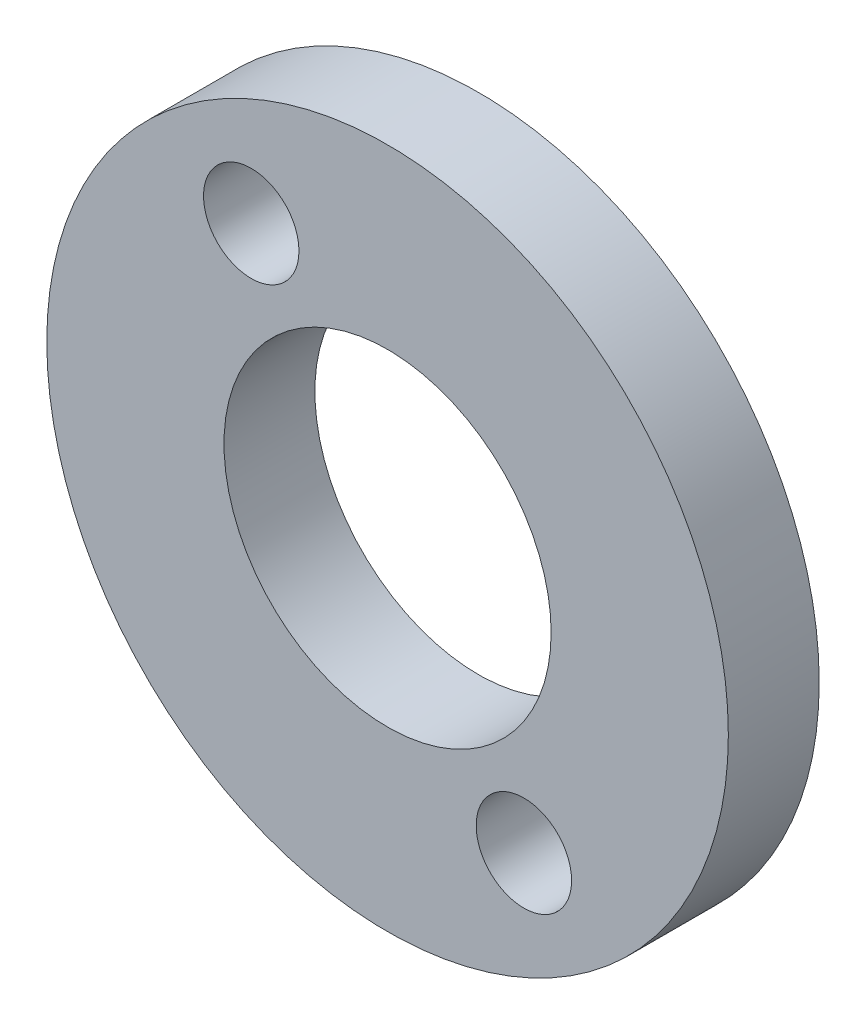
from build123d import *

# Parameters (mm, degrees)
ESQUISSE2_R        = 7.5
ESQUISSE2_R_2      = 1.05
ESQUISSE2_R_3      = 3.6
BOSS_EXTRU_1_DEPTH = 2


with BuildPart() as part:
    # Esquisse2 → Boss.-Extru.1 (new body)
    with BuildSketch(Plane.XY):
        Circle(ESQUISSE2_R)
        with Locations((-3, 4.5)):
            Circle(ESQUISSE2_R_2, mode=Mode.SUBTRACT)
        with Locations((3, -4.5)):
            Circle(ESQUISSE2_R_2, mode=Mode.SUBTRACT)
        Circle(ESQUISSE2_R_3, mode=Mode.SUBTRACT)
    extrude(amount=BOSS_EXTRU_1_DEPTH)


solid = part.part
